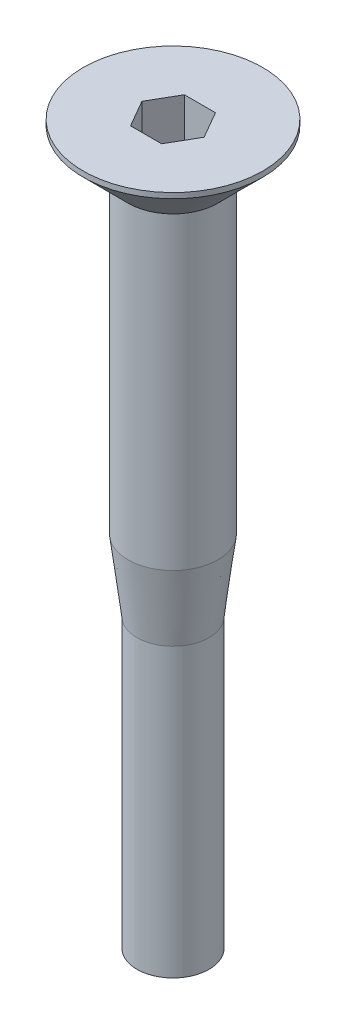
from build123d import *

# Parameters (mm, degrees)
SCHNITT_LINEAR_AUSTRAGEN1_DEPTH = 5.3


with BuildPart() as part:
    # Skizze1 → Basis-Rotation (revolve)
    with BuildSketch(Plane.XY, mode=Mode.PRIVATE) as basis_rotation_sk:
        Polygon((0, 0), (5, 0), (5, -0.3), (2.5, -2.8), (2.5, -20), (2.0095, -24), (2.0095, -40), (0, -40), align=None)
    revolve(basis_rotation_sk.sketch.rotate(Axis((0, 0, 0), (0, -1, 0)), 180), axis=Axis((0, 0, 0), (0, -1, 0)))

    # Skizze2 → Schnitt-Linear austragen1 (cut)
    with BuildSketch(Plane(origin=(0, 0, 0), x_dir=(-1, 0, 0), z_dir=(0, 1, 0))):
        Polygon((0.866025404, -1.5), (-0.866025404, -1.5), (-1.732050808, 0), (-0.866025404, 1.5), (0.866025404, 1.5), (1.732050808, 0), align=None)
    extrude(amount=-SCHNITT_LINEAR_AUSTRAGEN1_DEPTH, mode=Mode.SUBTRACT)


solid = part.part
